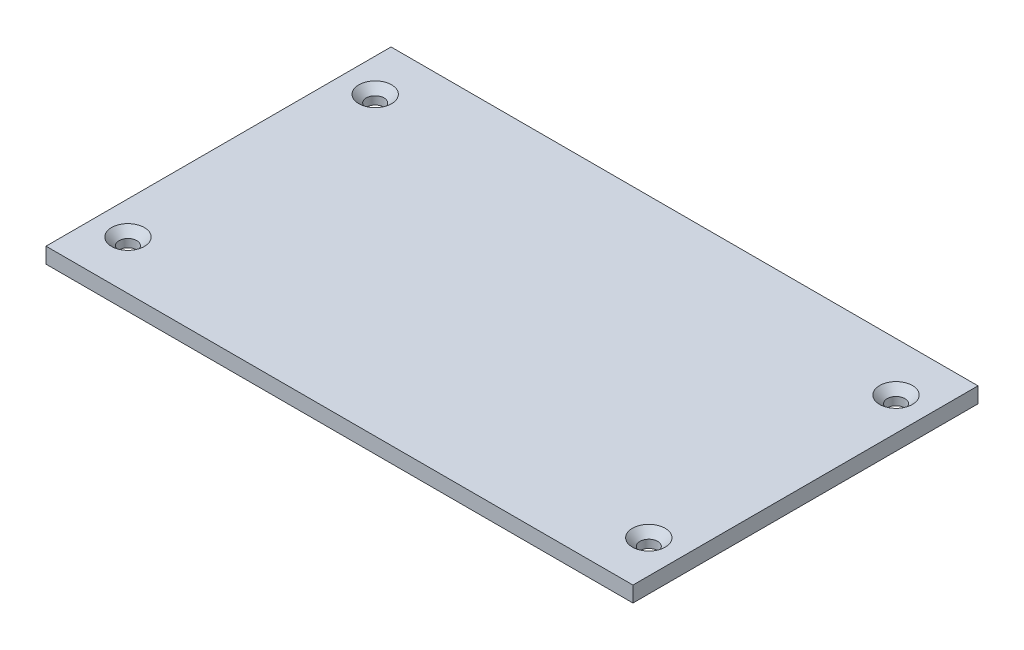
from build123d import *

# Parameters (mm, degrees)
SKETCH1_W                                    = 112.776
SKETCH1_H                                    = 66.294
BOSS_EXTRUDE1_DEPTH                          = 3
CSK_FOR_M3_COUNTERSUNK_FLAT_HEAD_SCR_2_COUNT = 2
CSK_FOR_M3_COUNTERSUNK_FLAT_HEAD_SCR_2_PITCH = 47.498
CSK_FOR_M3_COUNTERSUNK_FLAT_HEAD_SCR_3_COUNT = 2
CSK_FOR_M3_COUNTERSUNK_FLAT_HEAD_SCR_3_PITCH = 110.77574545
CSK_FOR_M3_COUNTERSUNK_FLAT_HEAD_SCR_4_COUNT = 2
CSK_FOR_M3_COUNTERSUNK_FLAT_HEAD_SCR_4_PITCH = 100.076


with BuildPart() as part:
    # Sketch1 → Boss-Extrude1 (new body)
    with BuildSketch(Plane(origin=(0, 0, 0), x_dir=(1, 0, 0), z_dir=(0, 1, 0))):
        Rectangle(SKETCH1_W, SKETCH1_H)
    extrude(amount=BOSS_EXTRUDE1_DEPTH)

    # Sketch3 → CSK for M3 Countersunk Flat Head Screw1 (revolve, cut)
    with BuildSketch(Plane(origin=(-50.038, 3, -23.749), x_dir=(0, 0, 1), z_dir=(1, 0, 0))):
        Polygon((0, 0), (0, 3), (1.7, 3), (1.7, 1.45), (3.15, 0), align=None)
    csk_for_m3_countersunk_flat_head_screw1 = revolve(axis=Axis((-50.038, 9.35, -23.749), (0, -1, 0)), mode=Mode.SUBTRACT)

    # CSK for M3 Countersunk Flat Head Scr 2: CSK for M3 Countersunk Flat Head Screw1 ×2
    with Locations(*[(0, 0, i * CSK_FOR_M3_COUNTERSUNK_FLAT_HEAD_SCR_2_PITCH) for i in range(1, CSK_FOR_M3_COUNTERSUNK_FLAT_HEAD_SCR_2_COUNT)]):
        add(csk_for_m3_countersunk_flat_head_screw1, mode=Mode.SUBTRACT)

    # CSK for M3 Countersunk Flat Head Scr 3: CSK for M3 Countersunk Flat Head Screw1 ×2
    with Locations(*[Vector(0.903410756510626, 0, 0.42877617123727685) * (i * CSK_FOR_M3_COUNTERSUNK_FLAT_HEAD_SCR_3_PITCH) for i in range(1, CSK_FOR_M3_COUNTERSUNK_FLAT_HEAD_SCR_3_COUNT)]):
        add(csk_for_m3_countersunk_flat_head_screw1, mode=Mode.SUBTRACT)

    # CSK for M3 Countersunk Flat Head Scr 4: CSK for M3 Countersunk Flat Head Screw1 ×2
    with Locations(*[(i * CSK_FOR_M3_COUNTERSUNK_FLAT_HEAD_SCR_4_PITCH, 0, 0) for i in range(1, CSK_FOR_M3_COUNTERSUNK_FLAT_HEAD_SCR_4_COUNT)]):
        add(csk_for_m3_countersunk_flat_head_screw1, mode=Mode.SUBTRACT)


solid = part.part
